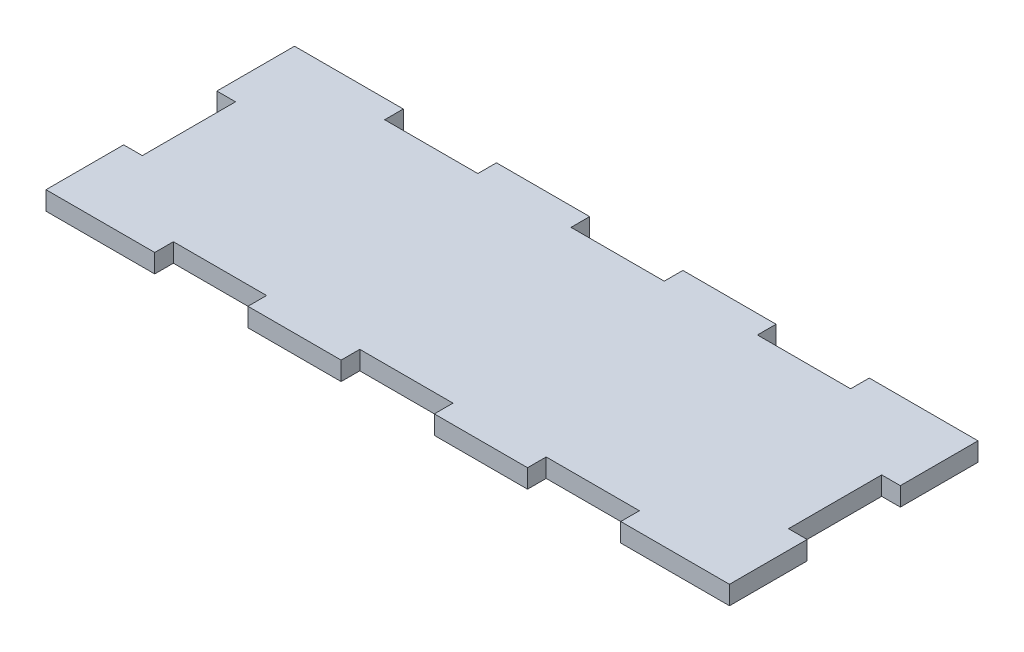
from build123d import *

# Parameters (mm, degrees)
SALIENTE_EXTRUIR2_DEPTH = 3


with BuildPart() as part:
    # Croquis1 → Saliente-Extruir2 (new body)
    with BuildSketch(Plane(origin=(0, 0, 0), x_dir=(1, 0, 0), z_dir=(0, 1, 0))):
        Polygon((3, 12.5), (3, 27.5), (0, 27.5), (0, 40), (17.5, 40), (17.5, 37), (32.5, 37), (32.5, 40), (47.5, 40), (47.5, 37), (62.5, 37), (62.5, 40), (77.5, 40), (77.5, 37), (92.5, 37), (92.5, 40), (110, 40), (110, 27.5), (107, 27.5), (107, 12.5), (110, 12.5), (110, 0), (92.5, 0), (92.5, 3), (77.5, 3), (77.5, 0), (62.5, 0), (62.5, 3), (47.5, 3), (47.5, 0), (32.5, 0), (32.5, 3), (17.5, 3), (17.5, 0), (0, 0), (0, 12.5), align=None)
    extrude(amount=SALIENTE_EXTRUIR2_DEPTH)


solid = part.part
